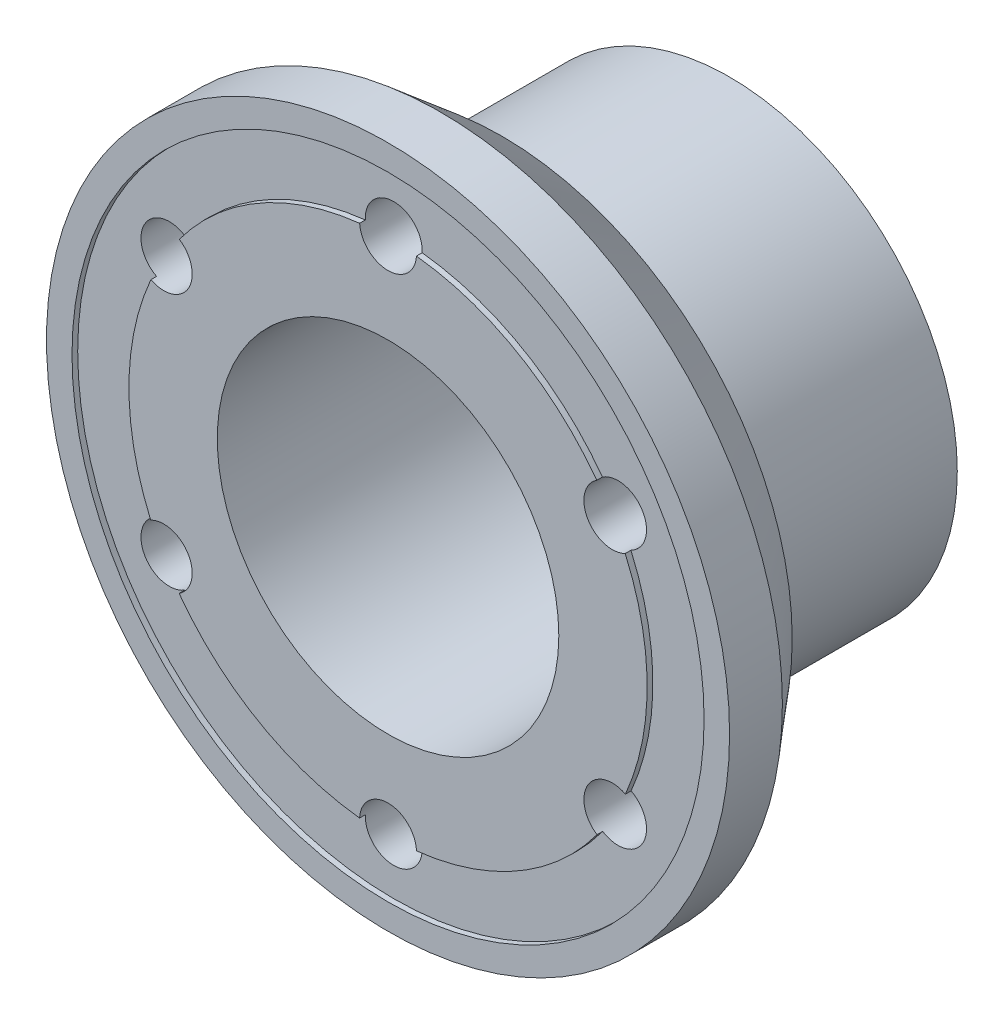
from build123d import *

# Parameters (mm, degrees)
SKETCH1_R                    = 40
SKETCH1_R_2                  = 27.5
BOSS_EXTRUDE1_DEPTH          = 40
SKETCH3_R                    = 60
BOSS_EXTRUDE2_DEPTH          = 20
SKETCH4_R                    = 30
SKETCH4_R_2                  = 5
CUT_EXTRUDE2_DEPTH           = 90
CHAMFER2_SIZE                = 9
CHAMFER2_SIZE2               = 10.725782333
CUT_EXTRUDE_THIN2_DEPTH      = 2
CUT_EXTRUDE_THIN2_DEPTH_BACK = 1
SKETCH6_R                    = 55.520808166
SKETCH6_R_2                  = 45.520808166


with BuildPart() as part:
    # Sketch1 → Boss-Extrude1 (new body)
    with BuildSketch(Plane.XY):
        Circle(SKETCH1_R)
        Circle(SKETCH1_R_2, mode=Mode.SUBTRACT)
    extrude(amount=BOSS_EXTRUDE1_DEPTH)

    # Sketch3 → Boss-Extrude2 (add)
    with BuildSketch(Plane.XY.offset(40)):
        Circle(SKETCH3_R)
    extrude(amount=BOSS_EXTRUDE2_DEPTH)

    # Sketch4 → Cut-Extrude2 (cut)
    with BuildSketch(Plane.XY.offset(60)):
        Circle(SKETCH4_R)
        with Locations((0, 45.541587837)):
            Circle(SKETCH4_R_2)
        with Locations((39.404155872, 22.791587837)):
            Circle(SKETCH4_R_2)
        with Locations((39.404155872, -22.708412163)):
            Circle(SKETCH4_R_2)
        with Locations((0, -45.458412163)):
            Circle(SKETCH4_R_2)
        with Locations((-39.404155872, -22.708412163)):
            Circle(SKETCH4_R_2)
        with Locations((-39.404155872, 22.791587837)):
            Circle(SKETCH4_R_2)
    extrude(amount=-CUT_EXTRUDE2_DEPTH, mode=Mode.SUBTRACT)

    # Chamfer2
    chamfer2_edges = [part.edges().sort_by_distance(p)[0] for p in [
        (-60, 0, 40),
    ]]
    chamfer2_side = [part.faces().sort_by_distance(p)[0] for p in [
        (-58.302943725, 0, 40),
    ]]
    chamfer(chamfer2_edges, length=CHAMFER2_SIZE, length2=CHAMFER2_SIZE2, reference=chamfer2_side[0])

    # Sketch6 → Cut-Extrude-Thin2 (cut, two sides: drawn at the far end of the back side and taken through both)
    with BuildSketch(Plane.XY.offset(60).offset(-CUT_EXTRUDE_THIN2_DEPTH_BACK)):
        Circle(SKETCH6_R)
        Circle(SKETCH6_R_2, mode=Mode.SUBTRACT)
    extrude(amount=CUT_EXTRUDE_THIN2_DEPTH + CUT_EXTRUDE_THIN2_DEPTH_BACK, mode=Mode.SUBTRACT)


solid = part.part
